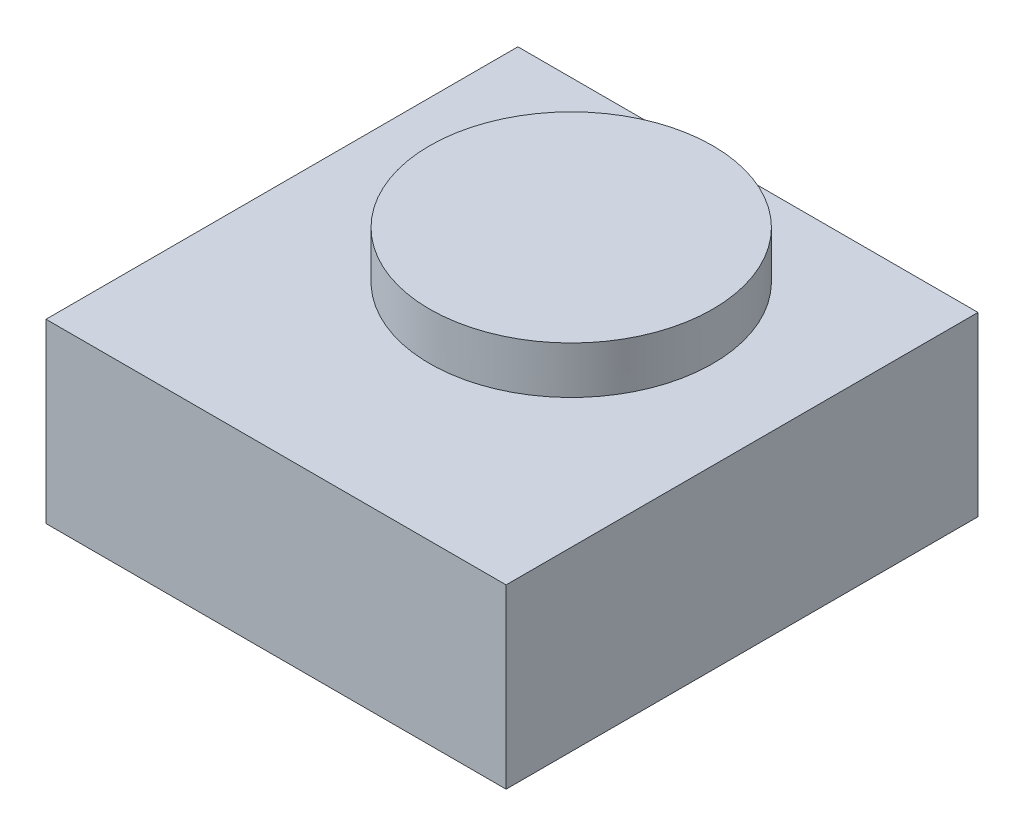
from build123d import *

# Parameters (mm, degrees)
SKETCH1_W           = 123.825
SKETCH1_H           = 127
BOSS_EXTRUDE1_DEPTH = 47.625
SKETCH2_R           = 38.1
BOSS_EXTRUDE2_DEPTH = 12.7


with BuildPart() as part:
    # Sketch1 → Boss-Extrude1 (new body)
    with BuildSketch(Plane(origin=(0, 0, 0), x_dir=(1, 0, 0), z_dir=(0, 1, 0))):
        with Locations((61.9125, 63.5)):
            Rectangle(SKETCH1_W, SKETCH1_H)
    extrude(amount=BOSS_EXTRUDE1_DEPTH)

    # Sketch2 → Boss-Extrude2 (add)
    with BuildSketch(Plane(origin=(0, 47.625, 0), x_dir=(1, 0, 0), z_dir=(0, 1, 0))):
        with Locations(Location((61.976, 79.375, 0), (0, 0, 90))):
            Circle(SKETCH2_R)
    extrude(amount=BOSS_EXTRUDE2_DEPTH)


solid = part.part
